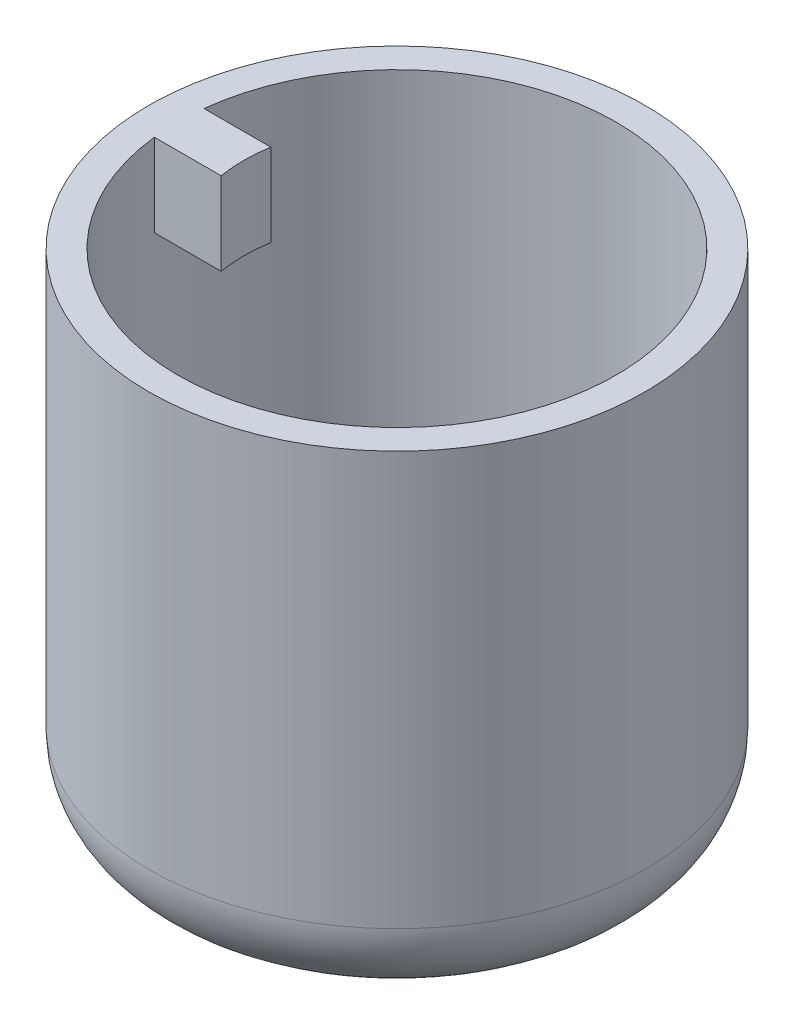
from build123d import *

# Parameters (mm, degrees)
SCHIZZO1_R                   = 15
ESTRUSIONE_ESTRUSIONE1_DEPTH = 30
SCHIZZO3_R                   = 5.75
TAGLIO_ESTRUSIONE1_DEPTH     = 2
SCHIZZO4_R                   = 13.25
TAGLIO_ESTRUSIONE2_DEPTH     = 36.128336141
ESTRUSIONE_ESTRUSIONE2_START = -5
ESTRUSIONE_ESTRUSIONE2_DEPTH = 5
RACCORDO1_R                  = 5


with BuildPart() as part:
    # Schizzo1 → Estrusione-Estrusione1 (new body)
    with BuildSketch(Plane(origin=(0, 0, 0), x_dir=(1, 0, 0), z_dir=(0, 1, 0))):
        with Locations(Location((0, 0, 0), (0, 0, 270))):
            Circle(SCHIZZO1_R)
    extrude(amount=ESTRUSIONE_ESTRUSIONE1_DEPTH)

    # Schizzo3 → Taglio-Estrusione1 (cut)
    with BuildSketch(Plane.XZ):
        with Locations(Location((0, 0, 0), (0, 0, 270))):
            Circle(SCHIZZO3_R)
    extrude(amount=-TAGLIO_ESTRUSIONE1_DEPTH, mode=Mode.SUBTRACT)

    # Schizzo4 → Taglio-Estrusione2 (cut, through all)
    with BuildSketch(Plane.XZ.offset(-2)):
        with Locations(Location((0, 0, 0), (0, 0, 270))):
            Circle(SCHIZZO4_R)
    extrude(amount=-TAGLIO_ESTRUSIONE2_DEPTH, mode=Mode.SUBTRACT)

    # Schizzo5 → Estrusione-Estrusione2 (add)
    with BuildSketch(Plane(origin=(0, 30, 0), x_dir=(1, 0, 0), z_dir=(0, 1, 0)).offset(ESTRUSIONE_ESTRUSIONE2_START)):
        with BuildLine():
            Line((-13.164820546, 1.5), (-9.127568132, 1.5))
            ThreePointArc((-9.127568132, 1.5), (-9.25, 0), (-9.127568132, -1.5))
            Line((-9.127568132, -1.5), (-13.164820546, -1.5))
            ThreePointArc((-13.164820546, -1.5), (-13.25, 0), (-13.164820546, 1.5))
        make_face()
    extrude(amount=ESTRUSIONE_ESTRUSIONE2_DEPTH)

    # Raccordo1
    raccordo1_edges = [part.edges().sort_by_distance(p)[0] for p in [
        (0, 0, -15),
    ]]
    fillet(raccordo1_edges, radius=RACCORDO1_R)


solid = part.part
